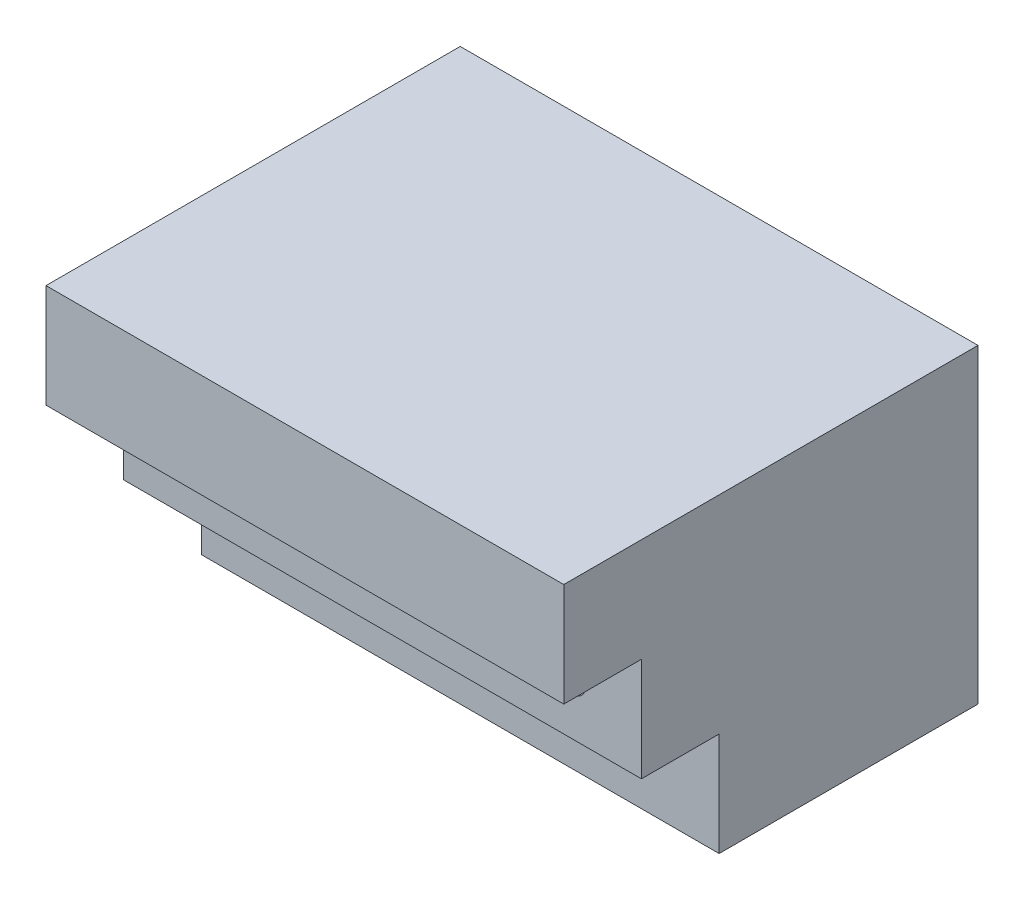
from build123d import *

# Parameters (mm, degrees)
SKETCH_1_W           = 200
SKETCH_1_H           = 40
EXTRUDE_1_DEPTH      = 100
SKETCH_1_3_W         = 200
SKETCH_1_3_H         = 40
EXTRUDE_2_DEPTH      = 130
SKETCH_10_W          = 200
SKETCH_10_H          = 40
EXTRUDE_3_DEPTH      = 160
SKETCH_12_R          = 5
CUT_EXTRUDE_8_DEPTH  = 50
CUT_EXTRUDE_8_DRAFT  = -1
SKETCH_12_5_R        = 5
CUT_EXTRUDE_9_DEPTH  = 45
CUT_EXTRUDE_9_DRAFT  = -1
SKETCH_12_6_R        = 5
CUT_EXTRUDE_10_DEPTH = 40
CUT_EXTRUDE_10_DRAFT = -1
SKETCH_12_7_R        = 5
CUT_EXTRUDE_11_DEPTH = 35
CUT_EXTRUDE_11_DRAFT = -1
SKETCH_12_8_R        = 5
CUT_EXTRUDE_12_DEPTH = 30
CUT_EXTRUDE_12_DRAFT = -1


with BuildPart() as part:
    # Эскиз1 → Бобышка-Вытянуть1 (new body)
    with BuildSketch(Plane.XY):
        with Locations((100, 20)):
            Rectangle(SKETCH_1_W, SKETCH_1_H)
    extrude(amount=EXTRUDE_1_DEPTH)

    # Эскиз1<3> → Бобышка-Вытянуть2 (add)
    with BuildSketch(Plane.XY):
        with Locations((100, 60)):
            Rectangle(SKETCH_1_3_W, SKETCH_1_3_H)
    extrude(amount=EXTRUDE_2_DEPTH)

    # Эскиз10 → Бобышка-Вытянуть3 (add)
    with BuildSketch(Plane(origin=(0, 0, 0), x_dir=(-1, 0, 0), z_dir=(0, 0, -1))):
        with Locations((-100, 100)):
            Rectangle(SKETCH_10_W, SKETCH_10_H)
    extrude(amount=-EXTRUDE_3_DEPTH)


with BuildPart() as cut_extrude_8_tool:
    # Эскиз12 → Вырез-Вытянуть8 (with draft: the straight prism first)
    with BuildSketch(Plane.XY.offset(130)):
        with Locations((24.220497744, 60)):
            Circle(SKETCH_12_R)
    extrude(amount=-CUT_EXTRUDE_8_DEPTH)
    # Вырез-Вытянуть8: the draft: its side faces are tilted about the plane it starts from
    cut_extrude_8_sides = [cut_extrude_8_tool.faces().sort_by_distance(p)[0] for p in [
        (19.220497744, 60, 105),
    ]]
    draft(cut_extrude_8_sides, Plane.XY.offset(130), CUT_EXTRUDE_8_DRAFT)


with BuildPart() as part_1:
    add(part.part)

    # Вырез-Вытянуть8: cut by cut_extrude_8_tool
    add(cut_extrude_8_tool.part, mode=Mode.SUBTRACT)


with BuildPart() as cut_extrude_9_tool:
    # Эскиз12<5> → Вырез-Вытянуть9 (with draft: the straight prism first)
    with BuildSketch(Plane.XY.offset(130)):
        with Locations((60.740492413, 60)):
            Circle(SKETCH_12_5_R)
    extrude(amount=-CUT_EXTRUDE_9_DEPTH)
    # Вырез-Вытянуть9: the draft: its side faces are tilted about the plane it starts from
    cut_extrude_9_sides = [cut_extrude_9_tool.faces().sort_by_distance(p)[0] for p in [
        (55.740492413, 60, 107.5),
    ]]
    draft(cut_extrude_9_sides, Plane.XY.offset(130), CUT_EXTRUDE_9_DRAFT)


with BuildPart() as part_2:
    add(part_1.part)

    # Вырез-Вытянуть9: cut by cut_extrude_9_tool
    add(cut_extrude_9_tool.part, mode=Mode.SUBTRACT)


with BuildPart() as cut_extrude_10_tool:
    # Эскиз12<6> → Вырез-Вытянуть10 (with draft: the straight prism first)
    with BuildSketch(Plane.XY.offset(130)):
        with Locations((100, 60)):
            Circle(SKETCH_12_6_R)
    extrude(amount=-CUT_EXTRUDE_10_DEPTH)
    # Вырез-Вытянуть10: the draft: its side faces are tilted about the plane it starts from
    cut_extrude_10_sides = [cut_extrude_10_tool.faces().sort_by_distance(p)[0] for p in [
        (95, 60, 110),
    ]]
    draft(cut_extrude_10_sides, Plane.XY.offset(130), CUT_EXTRUDE_10_DRAFT)


with BuildPart() as part_3:
    add(part_2.part)

    # Вырез-Вытянуть10: cut by cut_extrude_10_tool
    add(cut_extrude_10_tool.part, mode=Mode.SUBTRACT)


with BuildPart() as cut_extrude_11_tool:
    # Эскиз12<7> → Вырез-Вытянуть11 (with draft: the straight prism first)
    with BuildSketch(Plane.XY.offset(130)):
        with Locations((137.238261218, 60)):
            Circle(SKETCH_12_7_R)
    extrude(amount=-CUT_EXTRUDE_11_DEPTH)
    # Вырез-Вытянуть11: the draft: its side faces are tilted about the plane it starts from
    cut_extrude_11_sides = [cut_extrude_11_tool.faces().sort_by_distance(p)[0] for p in [
        (132.238261218, 60, 112.5),
    ]]
    draft(cut_extrude_11_sides, Plane.XY.offset(130), CUT_EXTRUDE_11_DRAFT)


with BuildPart() as part_4:
    add(part_3.part)

    # Вырез-Вытянуть11: cut by cut_extrude_11_tool
    add(cut_extrude_11_tool.part, mode=Mode.SUBTRACT)


with BuildPart() as cut_extrude_12_tool:
    # Эскиз12<8> → Вырез-Вытянуть12 (with draft: the straight prism first)
    with BuildSketch(Plane.XY.offset(130)):
        with Locations((173.42575674, 60)):
            Circle(SKETCH_12_8_R)
    extrude(amount=-CUT_EXTRUDE_12_DEPTH)
    # Вырез-Вытянуть12: the draft: its side faces are tilted about the plane it starts from
    cut_extrude_12_sides = [cut_extrude_12_tool.faces().sort_by_distance(p)[0] for p in [
        (168.42575674, 60, 115),
    ]]
    draft(cut_extrude_12_sides, Plane.XY.offset(130), CUT_EXTRUDE_12_DRAFT)


with BuildPart() as part_5:
    add(part_4.part)

    # Вырез-Вытянуть12: cut by cut_extrude_12_tool
    add(cut_extrude_12_tool.part, mode=Mode.SUBTRACT)


solid = part_5.part
